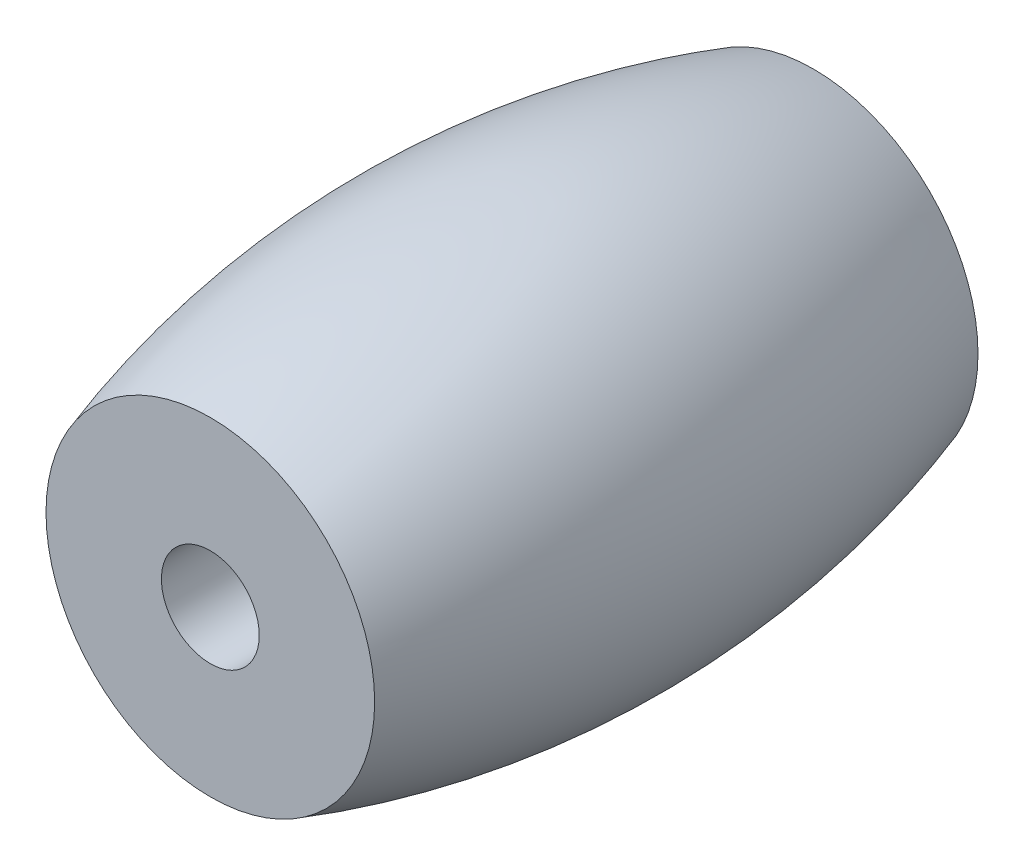
from build123d import *


with BuildPart() as part:
    # 草图2 → 旋转1 (revolve)
    with BuildSketch(Plane(origin=(0, 0, 0), x_dir=(1, 0, 0), z_dir=(0, 1, 0))):
        with BuildLine():
            Line((1.5, 0), (1.5, 18.5))
            Line((1.5, 18.5), (5.038351389, 18.5))
            ThreePointArc((5.038351389, 18.5), (6.5, 9.25), (5.038351389, 0))
            Line((5.038351389, 0), (1.5, 0))
        make_face()
    revolve(axis=Axis((0, 0, 0), (0, 0, -1)))


solid = part.part
